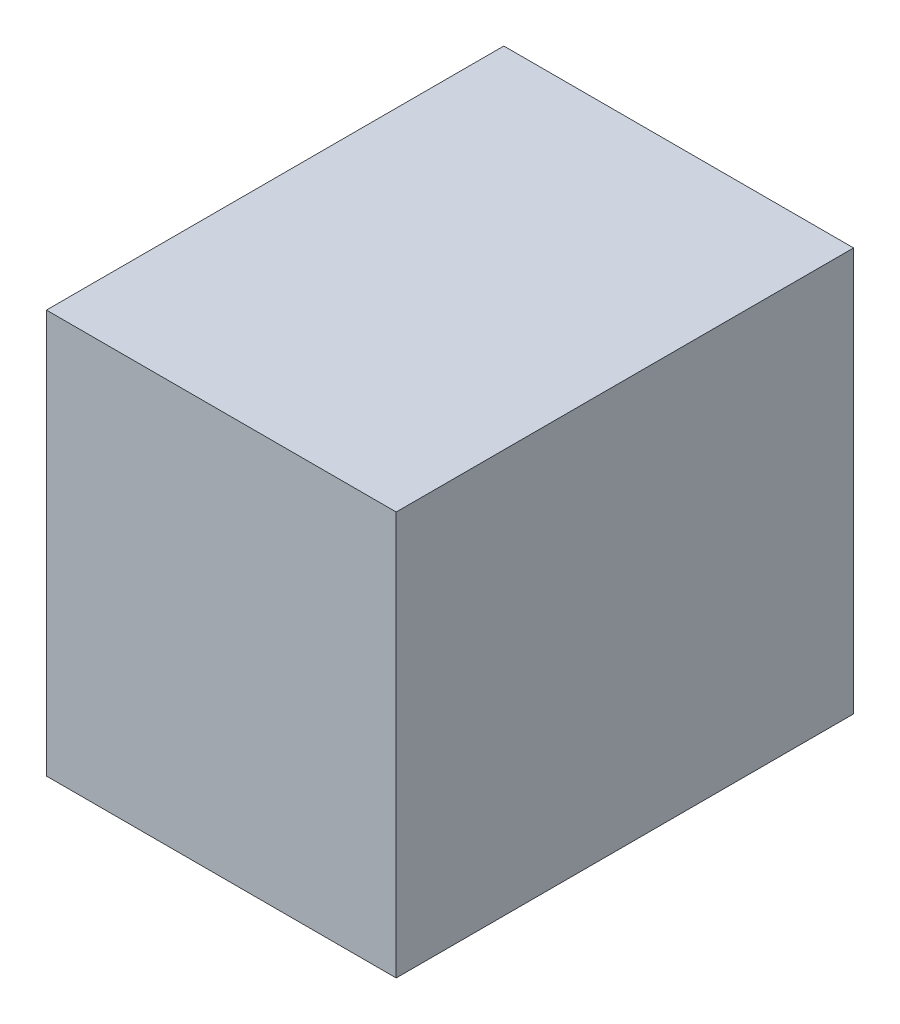
from build123d import *

# Parameters (mm, degrees)
SKETCH1_W           = 13
SKETCH1_H           = 17
BOSS_EXTRUDE1_DEPTH = 15


with BuildPart() as part:
    # Sketch1 → Boss-Extrude1 (new body)
    with BuildSketch(Plane(origin=(0, 0, 0), x_dir=(1, 0, 0), z_dir=(0, 1, 0))):
        Rectangle(SKETCH1_W, SKETCH1_H)
    extrude(amount=BOSS_EXTRUDE1_DEPTH)


solid = part.part
